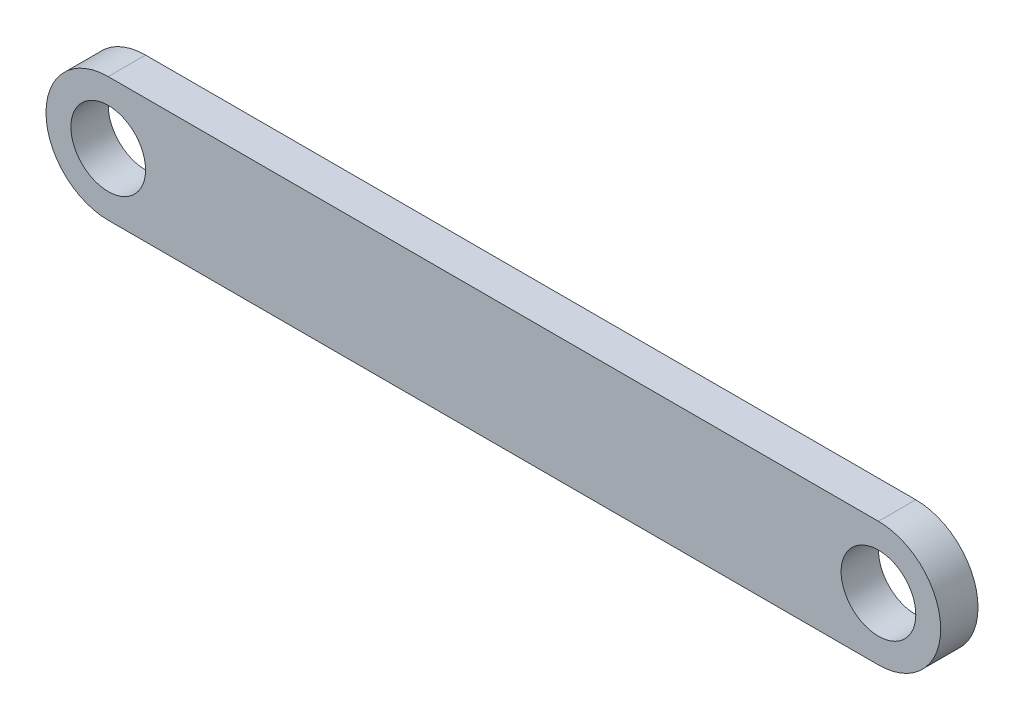
from build123d import *

# Parameters (mm, degrees)
SKETCH_1_R      = 3
EXTRUDE_1_DEPTH = 3


with BuildPart() as part:
    # ｽｹｯﾁ1 → ﾎﾞｽ - 押し出し1 (new body)
    with BuildSketch(Plane.XY):
        with BuildLine():
            Line((-30.95, 5), (30.95, 5))
            ThreePointArc((30.95, 5), (35.95, 0), (30.95, -5))
            Line((30.95, -5), (-30.95, -5))
            ThreePointArc((-30.95, -5), (-35.95, 0), (-30.95, 5))
        make_face()
        with Locations((-30.95, 0)):
            Circle(SKETCH_1_R, mode=Mode.SUBTRACT)
        with Locations((30.95, 0)):
            Circle(SKETCH_1_R, mode=Mode.SUBTRACT)
    extrude(amount=EXTRUDE_1_DEPTH)


solid = part.part
